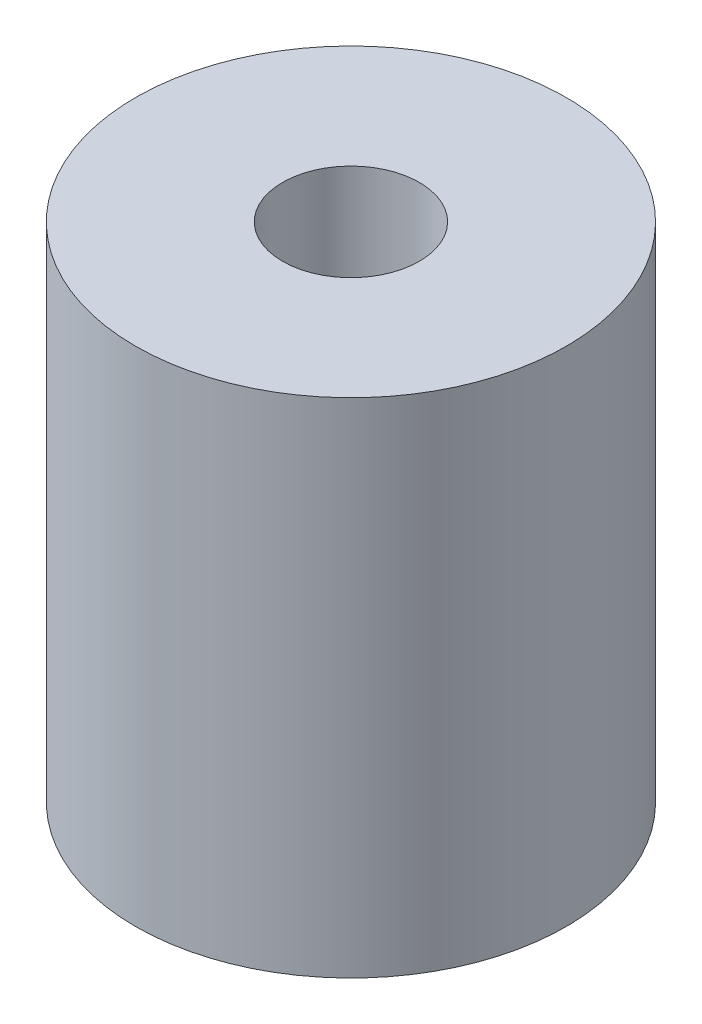
from build123d import *

# Parameters (mm, degrees)
SKETCH1_R           = 15
BOSS_EXTRUDE1_DEPTH = 35
SKETCH2_R           = 4.7625
CUT_EXTRUDE1_DEPTH  = 11.5
SKETCH3_R           = 5
CUT_EXTRUDE2_DEPTH  = 11.5


with BuildPart() as part:
    # Sketch1 → Boss-Extrude1 (new body)
    with BuildSketch(Plane(origin=(0, 0, 0), x_dir=(1, 0, 0), z_dir=(0, 1, 0))):
        with Locations(Location((0, 0, 0), (0, 0, 270))):
            Circle(SKETCH1_R)
    extrude(amount=BOSS_EXTRUDE1_DEPTH)

    # Sketch2 → Cut-Extrude1 (cut)
    with BuildSketch(Plane(origin=(0, 35, 0), x_dir=(1, 0, 0), z_dir=(0, 1, 0))):
        with Locations(Location((0, 0, 0), (0, 0, 270))):
            Circle(SKETCH2_R)
    extrude(amount=-CUT_EXTRUDE1_DEPTH, mode=Mode.SUBTRACT)

    # Sketch3 → Cut-Extrude2 (cut)
    with BuildSketch(Plane.XZ):
        with Locations(Location((0, 0, 0), (0, 0, 270))):
            Circle(SKETCH3_R)
    extrude(amount=-CUT_EXTRUDE2_DEPTH, mode=Mode.SUBTRACT)


solid = part.part
